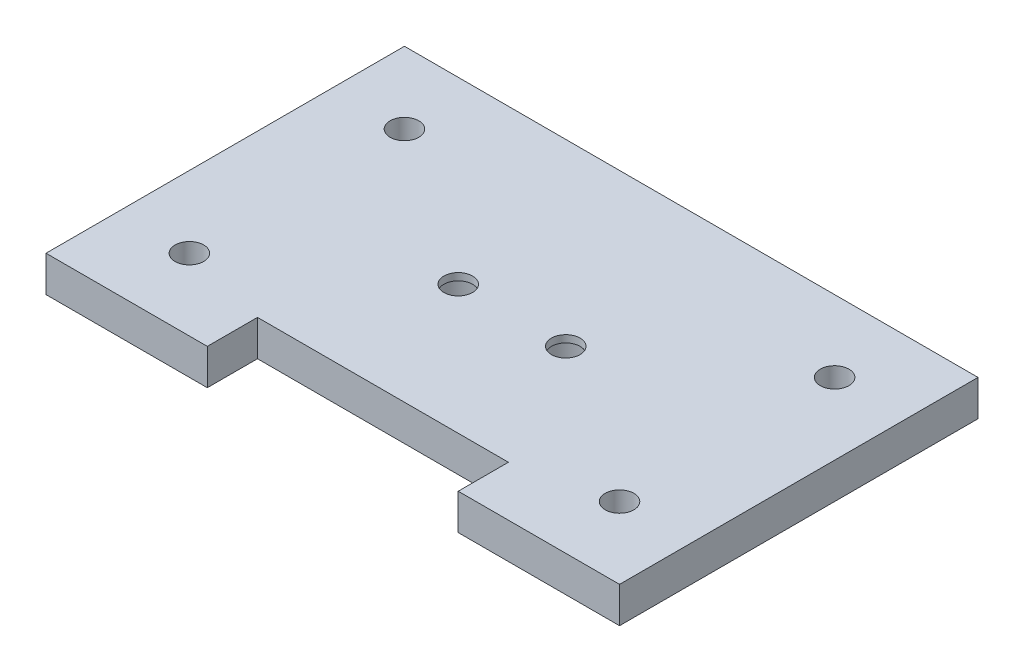
from build123d import *

# Parameters (mm, degrees)
SKETCH1_R           = 2
BOSS_EXTRUDE1_DEPTH = 5
SKETCH2_R           = 4
CUT_EXTRUDE1_DEPTH  = 4
SKETCH2_4_R         = 2
CUT_EXTRUDE2_DEPTH  = 48.434164903


with BuildPart() as part:
    # Sketch1 → Boss-Extrude1 (new body)
    with BuildSketch(Plane(origin=(0, 0, 0), x_dir=(1, 0, 0), z_dir=(0, 1, 0))):
        Polygon((-40, -25), (-17.5, -25), (-17.5, -18), (17.5, -18), (17.5, -25), (40, -25), (40, 25), (-40, 25), align=None)
        with Locations((-30, -15)):
            Circle(SKETCH1_R, mode=Mode.SUBTRACT)
        with Locations((30, -15)):
            Circle(SKETCH1_R, mode=Mode.SUBTRACT)
        with Locations((-30, 15)):
            Circle(SKETCH1_R, mode=Mode.SUBTRACT)
        with Locations((30, 15)):
            Circle(SKETCH1_R, mode=Mode.SUBTRACT)
    extrude(amount=BOSS_EXTRUDE1_DEPTH)

    # Sketch2 → Cut-Extrude1 (cut)
    with BuildSketch(Plane.XZ):
        with Locations((-7.5, 0)):
            Circle(SKETCH2_R)
        with Locations((7.5, 0)):
            Circle(SKETCH2_R)
    extrude(amount=-CUT_EXTRUDE1_DEPTH, mode=Mode.SUBTRACT)

    # Sketch2<4> → Cut-Extrude2 (cut, through all)
    with BuildSketch(Plane.XZ):
        with Locations((-7.5, 0)):
            Circle(SKETCH2_4_R)
        with Locations((7.5, 0)):
            Circle(SKETCH2_4_R)
    extrude(amount=-CUT_EXTRUDE2_DEPTH, mode=Mode.SUBTRACT)


solid = part.part
